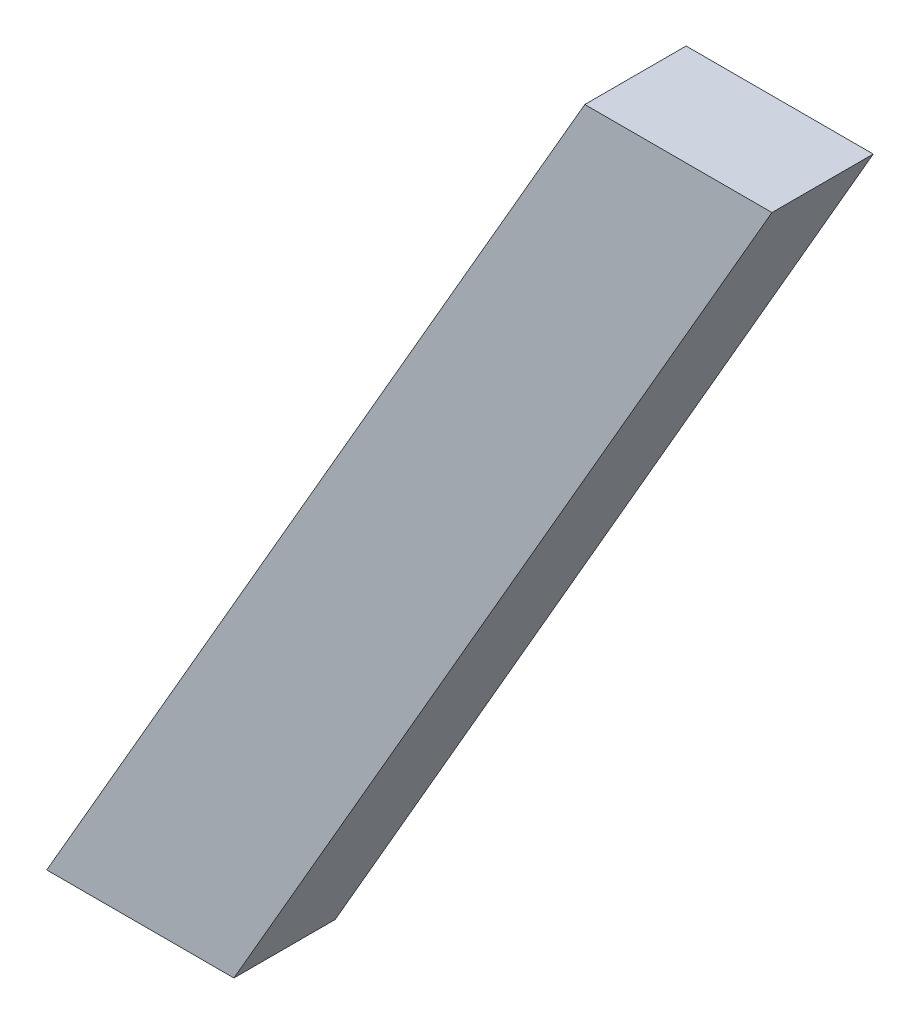
from build123d import *

# Parameters (mm, degrees)
BOSS_EXTRU_1_DEPTH = 25


with BuildPart() as part:
    # Esquisse1 → Boss.-Extru.1 (new body)
    with BuildSketch(Plane.XY):
        Polygon((0, 0), (46.188021535, 0), (178.978583449, 230), (132.790561914, 230), align=None)
    extrude(amount=BOSS_EXTRU_1_DEPTH)


solid = part.part
